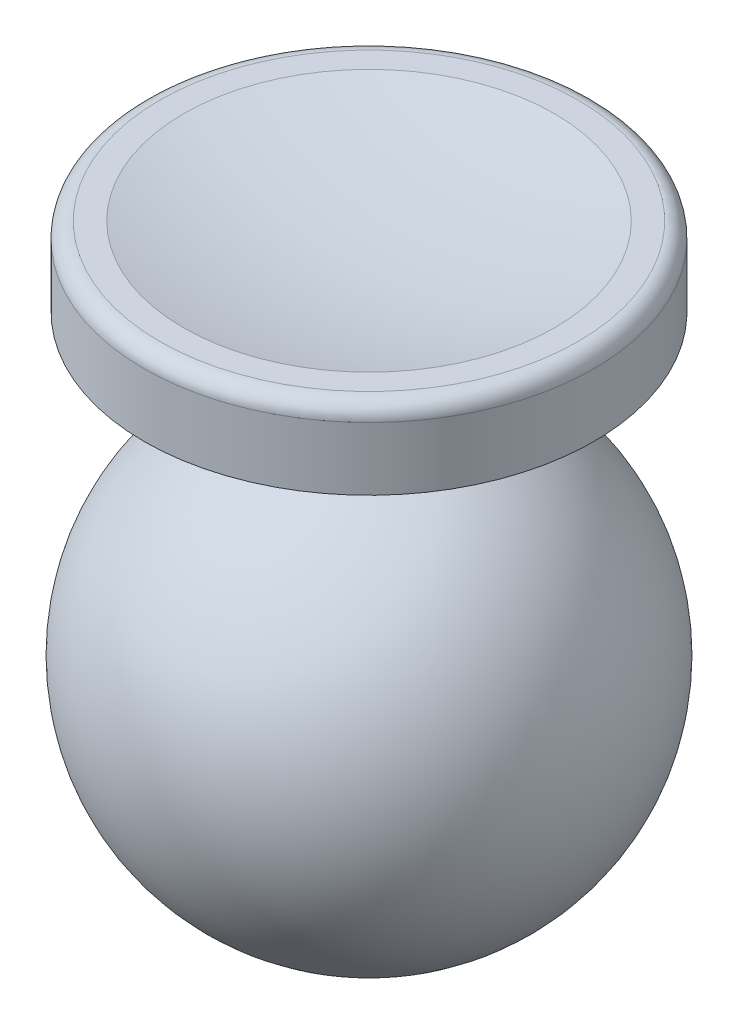
from build123d import *

# Parameters (mm, degrees)
FILLET1_R = 1


with BuildPart() as part:
    # Sketch1 → Revolve1 (revolve)
    with BuildSketch(Plane.XY, mode=Mode.PRIVATE) as revolve1_sk:
        with BuildLine():
            Line((0, 13.938923092), (0, -14.5))
            ThreePointArc((0, -14.5), (14.275933158, -2.539238563), (5, 13.610657589))
            Line((5, 13.610657589), (5, 15.5))
            Line((5, 15.5), (14.275933158, 18.876163564))
            Line((14.275933158, 18.876163564), (14.275933158, 23.876163564))
            Line((14.275933158, 23.876163564), (11.775933158, 23.876163564))
            ThreePointArc((11.775933158, 23.876163564), (5.935541292, 22.752672467), (0, 22.376163564))
            Line((0, 22.376163564), (0, 13.938923092))
        make_face()
    revolve(revolve1_sk.sketch.rotate(Axis((0, 13.938923092, 0), (0, -1, 0)), 90), axis=Axis((0, 13.938923092, 0), (0, -1, 0)))

    # Fillet1
    fillet1_edges = [part.edges().sort_by_distance(p)[0] for p in [
        (0, 13.610657589, -5),
        (0, 23.876163564, -14.275933158),
        (0, 15.5, -5),
    ]]
    fillet(fillet1_edges, radius=FILLET1_R)


solid = part.part
